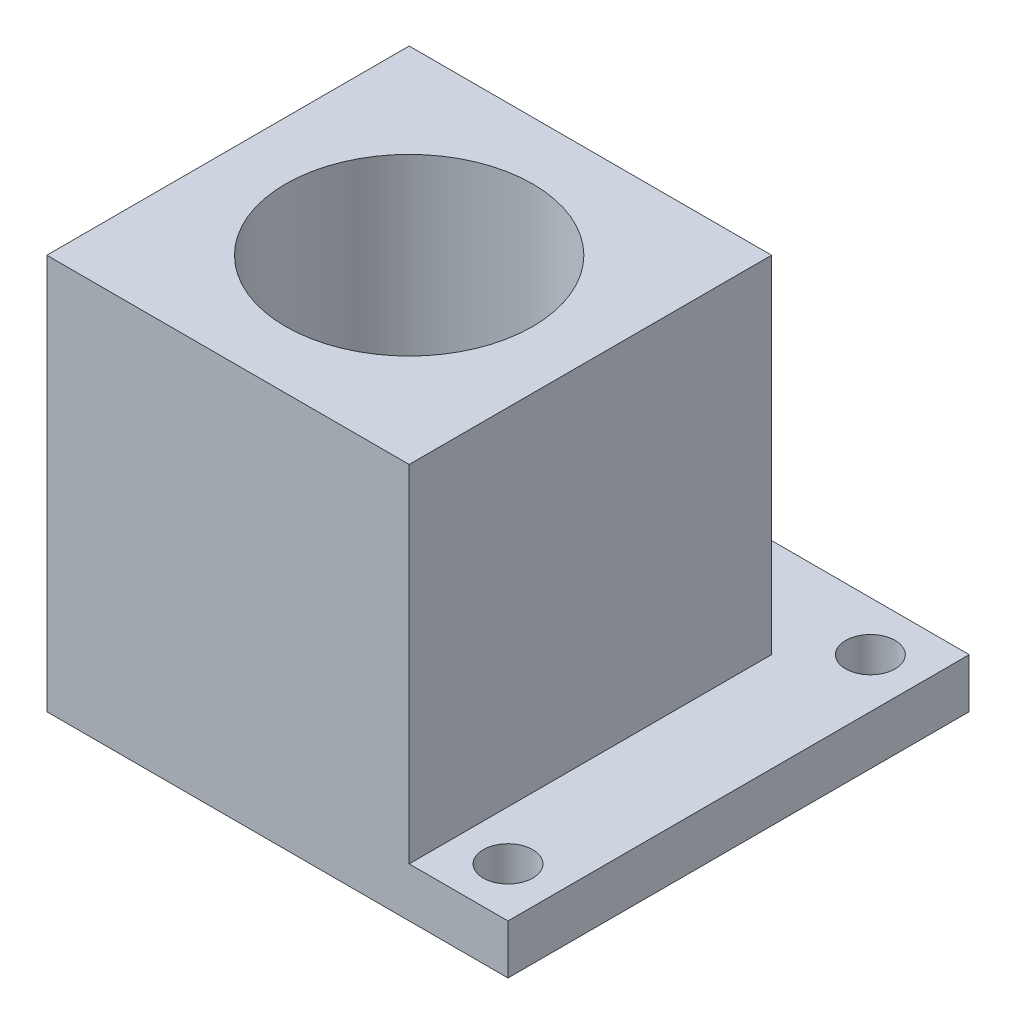
from build123d import *

# Parameters (mm, degrees)
SKETCH1_W           = 22
SKETCH1_H           = 22
SKETCH1_R           = 7.5
BOSS_EXTRUDE1_DEPTH = 24
SKETCH2_R           = 1.5
BOSS_EXTRUDE2_DEPTH = 3


with BuildPart() as part:
    # Sketch1 → Boss-Extrude1 (new body)
    with BuildSketch(Plane(origin=(0, 0, 0), x_dir=(1, 0, 0), z_dir=(0, 1, 0))):
        with Locations((11, 11)):
            Rectangle(SKETCH1_W, SKETCH1_H)
        with Locations(Location((11, 11, 0), (0, 0, 270))):
            Circle(SKETCH1_R, mode=Mode.SUBTRACT)
    extrude(amount=BOSS_EXTRUDE1_DEPTH)

    # Sketch2 → Boss-Extrude2 (add)
    with BuildSketch(Plane.XZ):
        Polygon((0, -22), (22, -22), (22, 0), (28, 0), (28, -28), (0, -28), align=None)
        with Locations(Location((25, -25, 0), (0, 0, 270))):
            Circle(SKETCH2_R, mode=Mode.SUBTRACT)
        with Locations(Location((25, -3, 0), (0, 0, 270))):
            Circle(SKETCH2_R, mode=Mode.SUBTRACT)
        with Locations(Location((3, -25, 0), (0, 0, 270))):
            Circle(SKETCH2_R, mode=Mode.SUBTRACT)
    extrude(amount=-BOSS_EXTRUDE2_DEPTH)


solid = part.part
